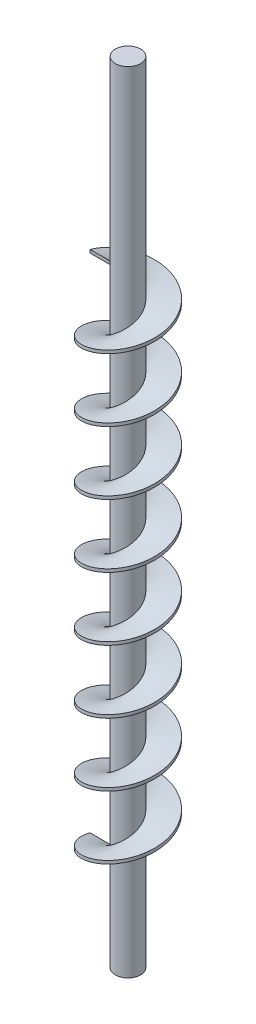
from build123d import *
from build123d.topology import SkipClean

# Parameters (mm, degrees)
SKETCH1_R           = 4
BOSS_EXTRUDE1_DEPTH = 220
SWEEP1_PITCH        = 20
SWEEP1_HEIGHT       = 160
SWEEP1_RADIUS       = 10
SWEEP1_START_ANGLE  = -90
SKETCH4_W           = 8
SKETCH4_H           = 1
BOSS_EXTRUDE2_START = 30
SKETCH6_R           = 4
BOSS_EXTRUDE2_DEPTH = 30


with BuildPart() as part:
    # Sketch1 → Boss-Extrude1 (new body)
    with BuildSketch(Plane(origin=(0, 0, 0), x_dir=(1, 0, 0), z_dir=(0, 1, 0))):
        with Locations(Location((0, 0, 0), (0, 0, 270))):
            Circle(SKETCH1_R)
    extrude(amount=BOSS_EXTRUDE1_DEPTH)

    # Sweep1: sweep along a helix
    with SkipClean():  # the faces are left unmerged after this step: merging them gives an invalid solid
        with BuildLine() as sweep1_path:
            add(Helix(SWEEP1_PITCH, SWEEP1_HEIGHT, SWEEP1_RADIUS, center=(0, 0, 0), direction=(0, 1, 0), mode=Mode.PRIVATE).rotate(Axis((0, 0, 0), (0, 1, 0)), SWEEP1_START_ANGLE))
        # Sketch4 → Sweep1 (sweep)
        with BuildSketch(Plane.XY):
            with Locations((-8, 0.5)):
                Rectangle(SKETCH4_W, SKETCH4_H)
        sweep(path=sweep1_path.line, is_frenet=True)

    # Sketch6 → Boss-Extrude2 (add)
    with BuildSketch(Plane.XZ.offset(BOSS_EXTRUDE2_START)):
        with Locations(Location((0, 0, 0), (0, 0, 270))):
            Circle(SKETCH6_R)
    extrude(amount=-BOSS_EXTRUDE2_DEPTH)


solid = part.part
